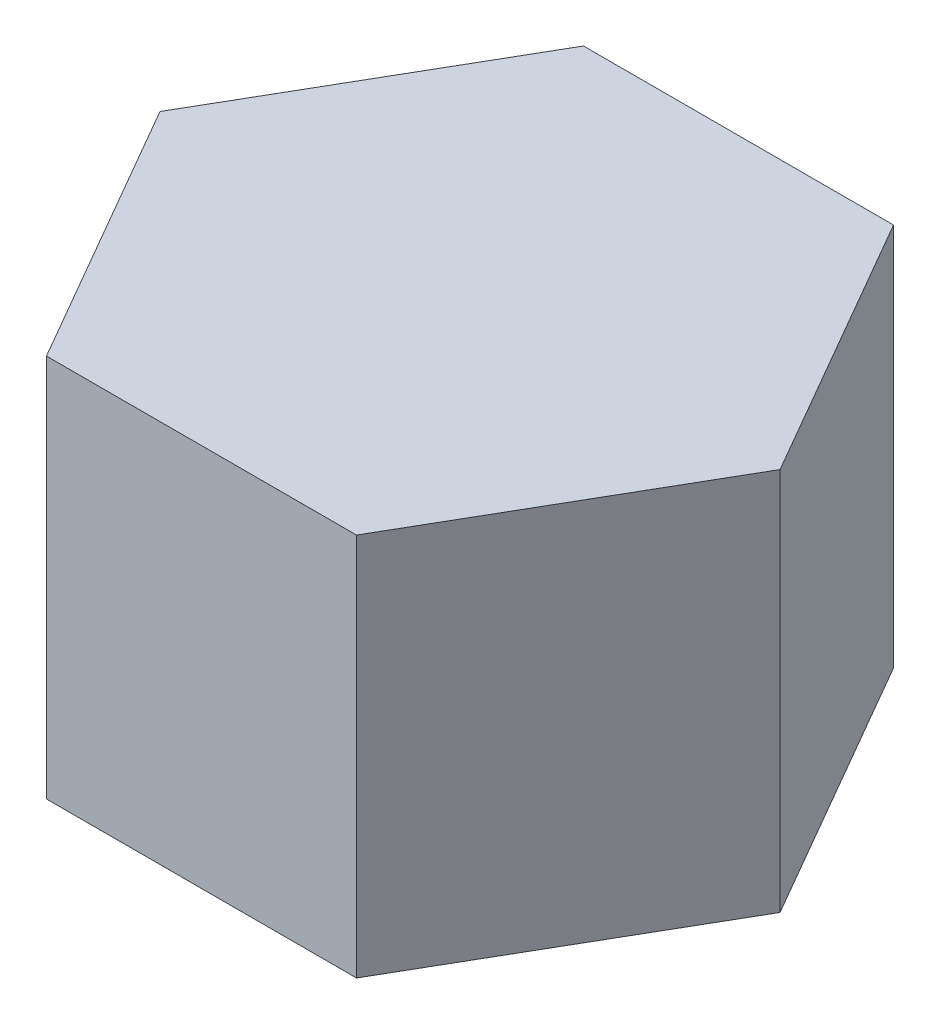
from build123d import *

# Parameters (mm, degrees)
EXTRUDE_1_DEPTH      = 80
EXTRUDE_1_DEPTH_BACK = 30


with BuildPart() as part:
    # 草图1 → 凸台-拉伸1 (new, two sides: drawn at the far end of the back side and taken through both)
    with BuildSketch(Plane(origin=(0, 0, 0), x_dir=(1, 0, 0), z_dir=(0, 1, 0)).offset(-EXTRUDE_1_DEPTH_BACK)):
        Polygon((88.911941455, 0), (44.455970728, 77), (-44.455970728, 77), (-88.911941455, 0), (-44.455970728, -77), (44.455970728, -77), align=None)
    extrude(amount=EXTRUDE_1_DEPTH + EXTRUDE_1_DEPTH_BACK)


solid = part.part
